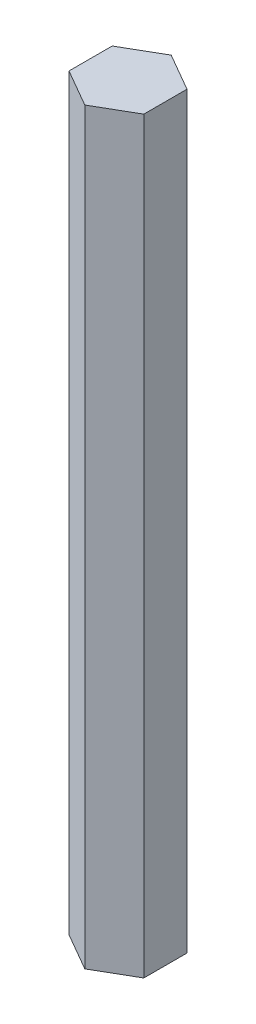
from build123d import *

# Parameters (mm, degrees)
BOSS_EXTRUDE1_DEPTH = 127


with BuildPart() as part:
    # Sketch1 → Boss-Extrude1 (new body)
    with BuildSketch(Plane(origin=(0, 0, 0), x_dir=(1, 0, 0), z_dir=(0, 1, 0))):
        Polygon((0, 7.332348419), (-6.35, 3.666174209), (-6.35, -3.666174209), (0, -7.332348419), (6.35, -3.666174209), (6.35, 3.666174209), align=None)
    extrude(amount=BOSS_EXTRUDE1_DEPTH)


solid = part.part
